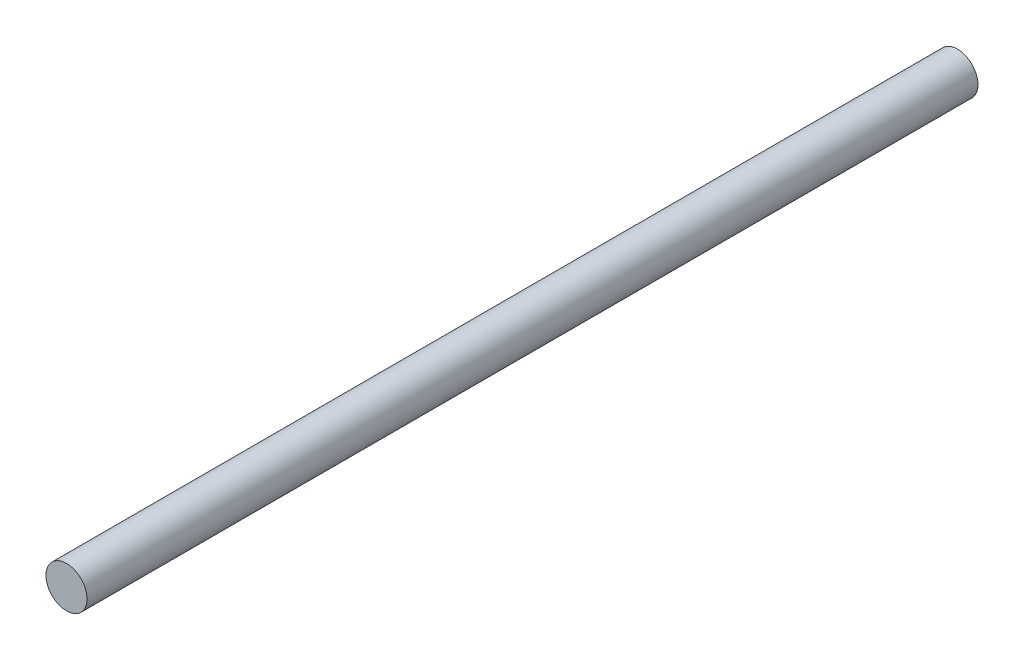
from build123d import *

# Parameters (mm, degrees)
SKETCH_1_R      = 1.5
EXTRUDE_1_DEPTH = 65


with BuildPart() as part:
    # 草图1 → 凸台-拉伸1 (new body)
    with BuildSketch(Plane.XY):
        Circle(SKETCH_1_R)
    extrude(amount=EXTRUDE_1_DEPTH)


solid = part.part
